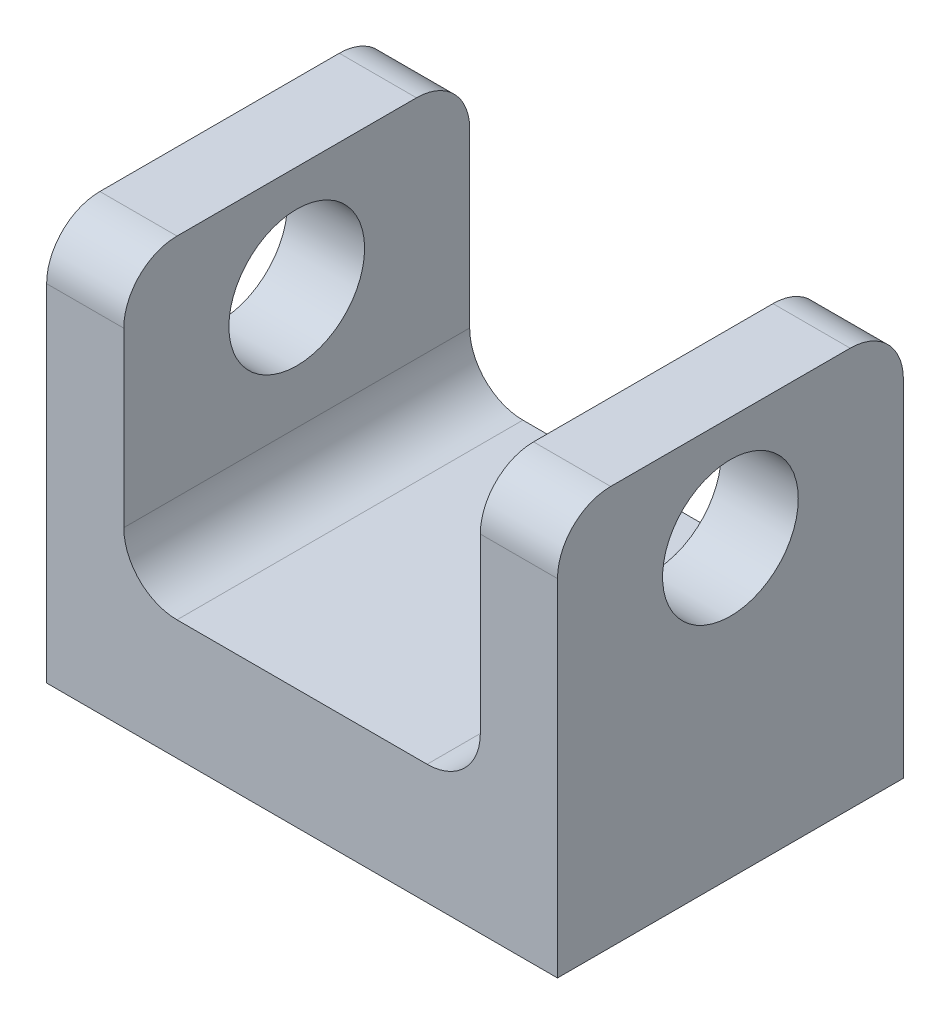
from build123d import *

# Parameters (mm, degrees)
SKETCH1_W               = 96
SKETCH1_H               = 75
BOSS_EXTRUDE1_DEPTH     = 65
SKETCH2_W               = 67
SKETCH2_H               = 104.92040837
CUT_EXTRUDE1_DEPTH      = 90.080020207
CUT_EXTRUDE2_DEPTH      = 111.785829419
CUT_EXTRUDE2_DEPTH_BACK = 111.785829419
SKETCH3_R               = 12.75
FILLET1_R               = 10


with BuildPart() as part:
    # Sketch1 → Boss-Extrude1 (new body)
    with BuildSketch(Plane.XY):
        Rectangle(SKETCH1_W, SKETCH1_H)
    extrude(amount=BOSS_EXTRUDE1_DEPTH)

    # Sketch2 → Cut-Extrude1 (cut, through all)
    with BuildSketch(Plane.XY.offset(65)):
        with Locations((0, 37.5)):
            Rectangle(SKETCH2_W, SKETCH2_H)
    extrude(amount=-CUT_EXTRUDE1_DEPTH, mode=Mode.SUBTRACT)

    # Sketch3 → Cut-Extrude2 (cut, two sides: drawn at the far end of the back side and taken through both)
    with BuildSketch(Plane(origin=(-33.5, 0, 0), x_dir=(0, 0, -1), z_dir=(1, 0, 0)).offset(-CUT_EXTRUDE2_DEPTH_BACK)):
        with Locations((-32.5, 17.878893252)):
            Circle(SKETCH3_R)
    extrude(amount=CUT_EXTRUDE2_DEPTH + CUT_EXTRUDE2_DEPTH_BACK, mode=Mode.SUBTRACT)

    # Fillet1
    fillet1_edges = [part.edges().sort_by_distance(p)[0] for p in [
        (-40.75, 37.5, 0),
        (-40.75, 37.5, 65),
        (-33.5, -14.960204185, 32.5),
        (33.5, -14.960204185, 32.5),
        (40.75, 37.5, 0),
        (40.75, 37.5, 65),
    ]]
    fillet(fillet1_edges, radius=FILLET1_R)


solid = part.part
